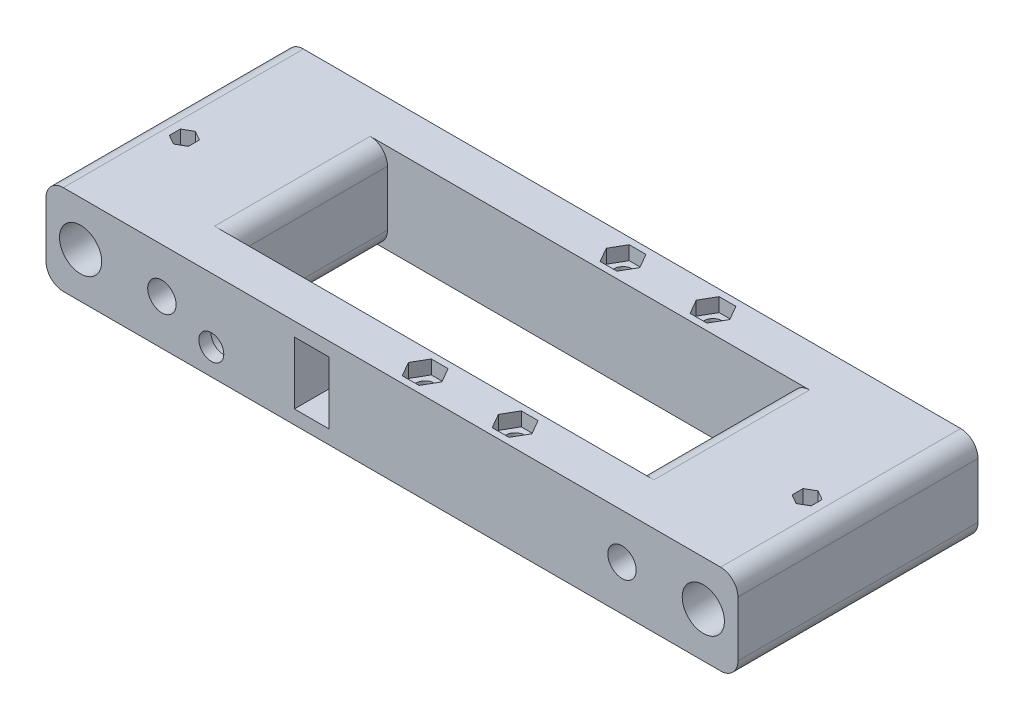
from build123d import *

# Parameters (mm, degrees)
SKETCH1_W           = 100
SKETCH1_H           = 26
SKETCH1_R           = 6.1
SKETCH1_R_2         = 4.1
BOSS_EXTRUDE1_DEPTH = 40
SKETCH2_W           = 100
SKETCH2_H           = 26
BOSS_EXTRUDE2_DEPTH = 29.4
CUT_EXTRUDE1_REACH  = 112.797
SKETCH3_W           = 58.5
SKETCH3_H           = 45
SKETCH4_R           = 2.6
CUT_EXTRUDE2_DEPTH  = 111.797111876
CUT_EXTRUDE3_DEPTH  = 4
CUT_EXTRUDE4_START  = -12.2
SKETCH6_W           = 10
SKETCH6_H           = 18
CUT_EXTRUDE4_DEPTH  = 12.2
FILLET1_R           = 5
CUT_EXTRUDE5_DEPTH  = 4
SKETCH8_R           = 2.6
BOSS_EXTRUDE3_DEPTH = 4
SKETCH9_R           = 2.6
BOSS_EXTRUDE4_DEPTH = 4
SKETCH10_R          = 1.5
CUT_EXTRUDE6_DEPTH  = 111.797111876
CUT_EXTRUDE7_DEPTH  = 4
HOLE1_D             = 7.2
HOLE1_DEPTH         = 12.2
HOLE1_CBORE_D       = 10
HOLE1_CBORE_DEPTH   = 8.7


with BuildPart() as part:
    # Sketch1 → Boss-Extrude1 (new body)
    with BuildSketch(Plane.XY):
        with Locations((-50, 13)):
            Rectangle(SKETCH1_W, SKETCH1_H)
        with Locations((-90, 13)):
            Circle(SKETCH1_R, mode=Mode.SUBTRACT)
        with Locations((-66.5, 13)):
            Circle(SKETCH1_R_2, mode=Mode.SUBTRACT)
    boss_extrude1 = extrude(amount=BOSS_EXTRUDE1_DEPTH)

    # Sketch2 → Boss-Extrude2 (add)
    with BuildSketch(Plane(origin=(0, 0, 0), x_dir=(-1, 0, 0), z_dir=(0, 0, -1))):
        with Locations((50, 13)):
            Rectangle(SKETCH2_W, SKETCH2_H)
    boss_extrude2 = extrude(amount=BOSS_EXTRUDE2_DEPTH)

    # Sketch3 → Cut-Extrude1 (cut, up to next)
    with BuildSketch(Plane(origin=(0, 26, 0), x_dir=(1, 0, 0), z_dir=(0, 1, 0)), mode=Mode.PRIVATE) as cut_extrude1_sk1:
        with Locations((-29.25, -5.3)):
            Rectangle(SKETCH3_W, SKETCH3_H)
    cut_extrude1_tool1 = extrude(cut_extrude1_sk1.sketch, amount=-CUT_EXTRUDE1_REACH, mode=Mode.PRIVATE) & part.part
    cut_extrude1 = cut_extrude1_tool1.solids().sort_by_distance((-29.25, 26, 5.3))[0]
    add(cut_extrude1, mode=Mode.SUBTRACT)

    # Mirror2: Boss-Extrude1, Boss-Extrude2, Cut-Extrude1 across plane
    add(boss_extrude1.mirror(Plane(origin=(0, 0, 40), x_dir=(0, 0, 1), z_dir=(-1, 0, 0))))
    add(boss_extrude2.mirror(Plane(origin=(0, 0, 40), x_dir=(0, 0, 1), z_dir=(-1, 0, 0))))
    add(cut_extrude1.mirror(Plane(origin=(0, 0, 40), x_dir=(0, 0, 1), z_dir=(-1, 0, 0))), mode=Mode.SUBTRACT)

    # Sketch4 → Cut-Extrude2 (cut, through all)
    with BuildSketch(Plane(origin=(0, 26, 0), x_dir=(1, 0, 0), z_dir=(0, 1, 0))):
        with Locations(Location((3.5, 23.3, 0), (0, 0, 180))):
            Circle(SKETCH4_R)
        with Locations(Location((29.5, 23.3, 0), (0, 0, 180))):
            Circle(SKETCH4_R)
    cut_extrude2 = extrude(amount=-CUT_EXTRUDE2_DEPTH, mode=Mode.SUBTRACT)

    # Sketch5 → Cut-Extrude3 (cut)
    with BuildSketch(Plane.XZ):
        Polygon((34.234272207, -23.3), (31.867136104, -19.2), (27.132863896, -19.2), (24.765727793, -23.3), (27.132863896, -27.4), (31.867136104, -27.4), align=None)
        Polygon((-1.234272207, -23.3), (1.132863896, -27.4), (5.867136104, -27.4), (8.234272207, -23.3), (5.867136104, -19.2), (1.132863896, -19.2), align=None)
    cut_extrude3 = extrude(amount=-CUT_EXTRUDE3_DEPTH, mode=Mode.SUBTRACT)

    # Mirror3: Cut-Extrude2, Cut-Extrude3 across plane
    add(cut_extrude2.mirror(Plane.XY.offset(5.3)), mode=Mode.SUBTRACT)
    add(cut_extrude3.mirror(Plane.XY.offset(5.3)), mode=Mode.SUBTRACT)

    # Sketch6 → Cut-Extrude4 (cut)
    with BuildSketch(Plane.XY.offset(40).offset(CUT_EXTRUDE4_START)):
        with Locations((-23.2, 13)):
            Rectangle(SKETCH6_W, SKETCH6_H)
    extrude(amount=CUT_EXTRUDE4_DEPTH, mode=Mode.SUBTRACT)

    # Fillet1
    fillet1_edges = [part.edges().sort_by_distance(p)[0] for p in [
        (-58.5, 26, 5.3),
        (-58.5, 0, 5.3),
        (100, 0, 5.3),
        (100, 26, 5.3),
        (-100, 0, 5.3),
        (-100, 26, 5.3),
        (58.5, 0, 5.3),
        (58.5, 26, 5.3),
    ]]
    fillet(fillet1_edges, radius=FILLET1_R)

    # Sketch7 → Cut-Extrude5 (cut)
    with BuildSketch(Plane(origin=(0, 26, 0), x_dir=(1, 0, 0), z_dir=(0, 1, 0))):
        Polygon((8.349742261, 23.3), (5.924871131, 27.5), (1.075128869, 27.5), (-1.349742261, 23.3), (1.075128869, 19.1), (5.924871131, 19.1), align=None)
        Polygon((34.349742261, 23.3), (31.924871131, 27.5), (27.075128869, 27.5), (24.650257739, 23.3), (27.075128869, 19.1), (31.924871131, 19.1), align=None)
    cut_extrude5 = extrude(amount=-CUT_EXTRUDE5_DEPTH, mode=Mode.SUBTRACT)

    # Mirror4: Cut-Extrude5 across plane
    add(cut_extrude5.mirror(Plane.XY.offset(5.3)), mode=Mode.SUBTRACT)

    # Sketch8 → Boss-Extrude3 (add)
    # profile 1 of 2: a face of its own
    with BuildSketch(Plane.XZ.offset(-4)):
        Polygon((27.132863896, 38), (31.867136104, 38), (34.234272207, 33.9), (31.867136104, 29.8), (27.132863896, 29.8), (24.765727793, 33.9), align=None)
        with Locations(Location((29.5, 33.9, 0), (0, 0, 180))):
            Circle(SKETCH8_R, mode=Mode.SUBTRACT)
    # profile 2 of 2: a face of its own
    with BuildSketch(Plane.XZ.offset(-4)):
        Polygon((1.132863896, 38), (5.867136104, 38), (8.234272207, 33.9), (5.867136104, 29.8), (1.132863896, 29.8), (-1.234272207, 33.9), align=None)
        with Locations(Location((3.5, 33.9, 0), (0, 0, 180))):
            Circle(SKETCH8_R, mode=Mode.SUBTRACT)
    extrude(amount=BOSS_EXTRUDE3_DEPTH)

    # Sketch9 → Boss-Extrude4 (add)
    # profile 1 of 2: a face of its own
    with BuildSketch(Plane.XZ.offset(-4)):
        Polygon((31.867136104, -19.2), (27.132863896, -19.2), (24.765727793, -23.3), (27.132863896, -27.4), (31.867136104, -27.4), (34.234272207, -23.3), align=None)
        with Locations(Location((29.5, -23.3, 0), (0, 0, 180))):
            Circle(SKETCH9_R, mode=Mode.SUBTRACT)
    # profile 2 of 2: a face of its own
    with BuildSketch(Plane.XZ.offset(-4)):
        Polygon((1.132863896, -19.2), (-1.234272207, -23.3), (1.132863896, -27.4), (5.867136104, -27.4), (8.234272207, -23.3), (5.867136104, -19.2), align=None)
        with Locations(Location((3.5, -23.3, 0), (0, 0, 180))):
            Circle(SKETCH9_R, mode=Mode.SUBTRACT)
    extrude(amount=BOSS_EXTRUDE4_DEPTH)

    # Sketch10 → Cut-Extrude6 (cut, through all)
    with BuildSketch(Plane.XZ):
        with Locations(Location((-90, 10, 0), (0, 0, 270))):
            Circle(SKETCH10_R)
        with Locations(Location((90, 10, 0), (0, 0, 270))):
            Circle(SKETCH10_R)
    extrude(amount=-CUT_EXTRUDE6_DEPTH, mode=Mode.SUBTRACT)

    # Sketch11 → Cut-Extrude7 (cut)
    with BuildSketch(Plane(origin=(0, 26, 0), x_dir=(1, 0, 0), z_dir=(0, 1, 0))):
        Polygon((-90, -13.175426481), (-87.25, -11.58771324), (-87.25, -8.41228676), (-90, -6.824573519), (-92.75, -8.41228676), (-92.75, -11.58771324), align=None)
        Polygon((90, -13.175426481), (92.75, -11.58771324), (92.75, -8.41228676), (90, -6.824573519), (87.25, -8.41228676), (87.25, -11.58771324), align=None)
    extrude(amount=-CUT_EXTRUDE7_DEPTH, mode=Mode.SUBTRACT)

    # Hole1
    with Locations(Plane(origin=(-52.21, 7.5, 27.8), x_dir=(-1, 0, 0), z_dir=(0, 0, -1))):
        with Locations((0, 0)):
            CounterBoreHole(HOLE1_D / 2, HOLE1_CBORE_D / 2, HOLE1_CBORE_DEPTH, depth=HOLE1_DEPTH)


solid = part.part
